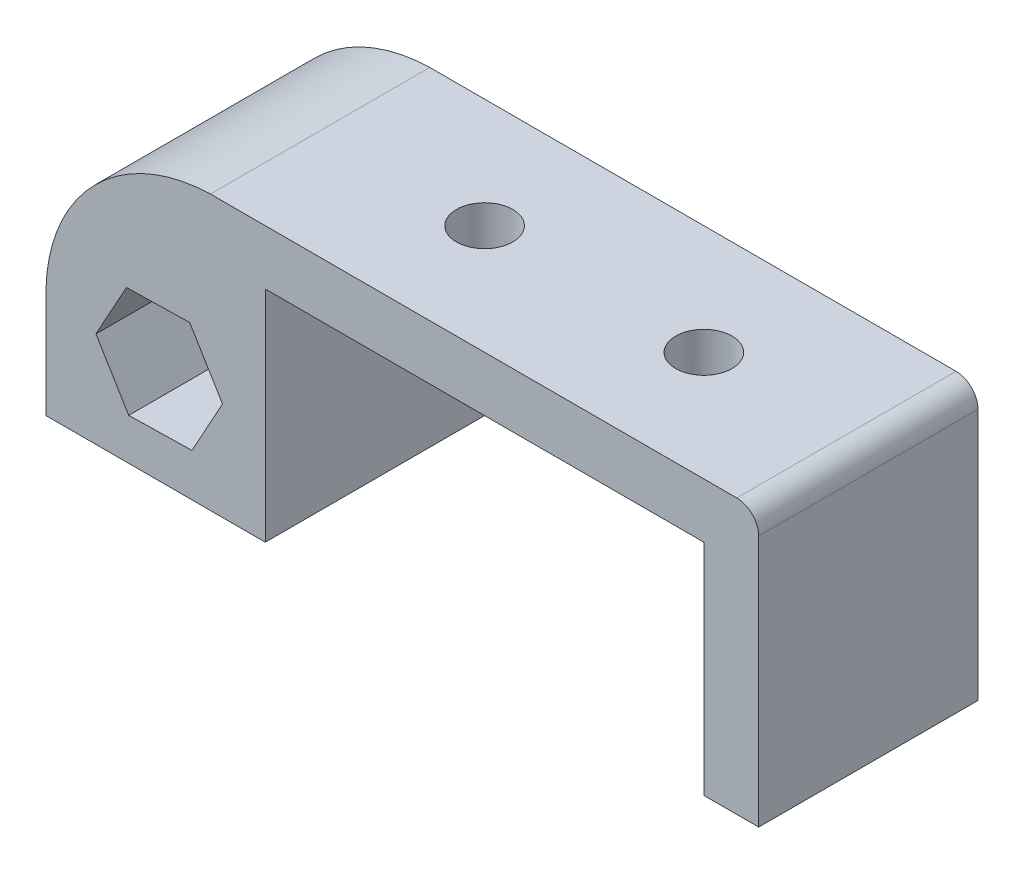
from build123d import *

# Parameters (mm, degrees)
BOSS_EXTRUDE2_DEPTH = 25.4
SKETCH2_R           = 3.2639
CUT_EXTRUDE1_DEPTH  = 71.138042459


with BuildPart() as part:
    # Sketch1 → Boss-Extrude2 (new body)
    with BuildSketch(Plane.XY):
        with BuildLine():
            Line((50.8, 0), (57.15, 0))
            Line((57.15, 0), (57.15, 29.21))
            ThreePointArc((57.15, 29.21), (56.406051224, 31.006051224), (54.61, 31.75))
            Line((54.61, 31.75), (-6.35, 31.75))
            ThreePointArc((-6.35, 31.75), (-19.678174928, 26.028174928), (-25.4, 12.7))
            Line((-25.4, 12.7), (-25.4, 0))
            Line((-25.4, 0), (0, 0))
            Line((0, 0), (0, 25.4))
            Line((0, 25.4), (50.8, 25.4))
            Line((50.8, 25.4), (50.8, 0))
        make_face()
        Polygon((-8.489396689, 4.967655623), (-4.955326016, 11.392114963), (-8.752035673, 17.664939614), (-16.082816004, 17.513304926), (-19.616886677, 11.088845586), (-15.820177019, 4.816020934), align=None, mode=Mode.SUBTRACT)
    extrude(amount=BOSS_EXTRUDE2_DEPTH)

    # Sketch2 → Cut-Extrude1 (cut, through all)
    with BuildSketch(Plane(origin=(0, 31.75, 0), x_dir=(1, 0, 0), z_dir=(0, 1, 0))):
        with Locations(Location((12.7, -12.7, 0), (0, 0, 180))):
            Circle(SKETCH2_R)
        with Locations(Location((38.1, -12.7, 0), (0, 0, 270))):
            Circle(SKETCH2_R)
    extrude(amount=-CUT_EXTRUDE1_DEPTH, mode=Mode.SUBTRACT)


solid = part.part
